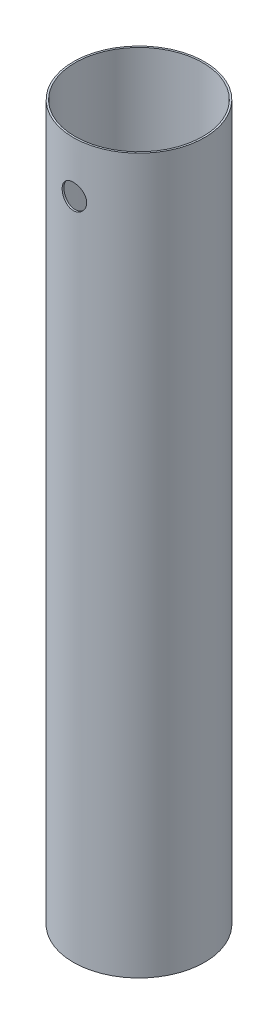
from build123d import *

# Parameters (mm, degrees)
CROQUIS1_R              = 57
CROQUIS1_R_2            = 55.5
SALIENTE_EXTRUIR1_DEPTH = 620
CROQUIS2_R              = 10.65
CORTAR_EXTRUIR1_DEPTH   = 10


with BuildPart() as part:
    # Croquis1 → Saliente-Extruir1 (new body)
    with BuildSketch(Plane(origin=(0, 0, 0), x_dir=(1, 0, 0), z_dir=(0, 1, 0))):
        with Locations(Location((0, 0, 0), (0, 0, 270))):
            Circle(CROQUIS1_R)
        with Locations(Location((0, 0, 0), (0, 0, 270))):
            Circle(CROQUIS1_R_2, mode=Mode.SUBTRACT)
    extrude(amount=SALIENTE_EXTRUIR1_DEPTH)

    # Croquis2 → Cortar-Extruir1 (cut)
    with BuildSketch(Plane.XY.offset(57)):
        with Locations((0, 575.741472633)):
            Circle(CROQUIS2_R)
    extrude(amount=-CORTAR_EXTRUIR1_DEPTH, mode=Mode.SUBTRACT)


solid = part.part
